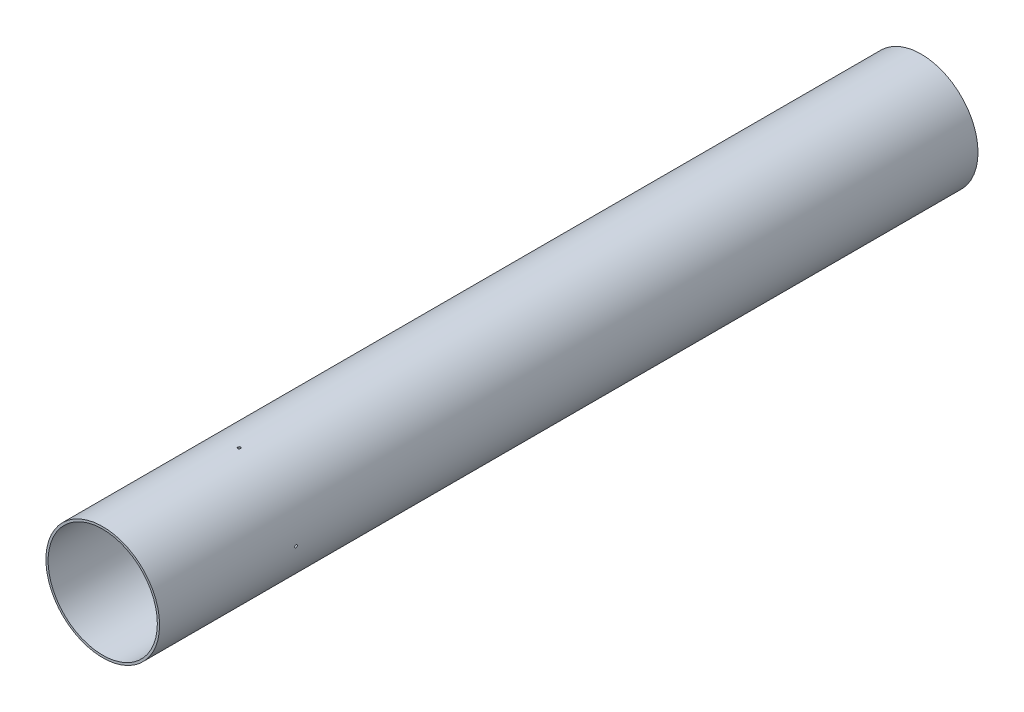
from build123d import *

# Parameters (mm, degrees)
SKETCH1_R           = 31.75
SKETCH1_R_2         = 30.5054
BOSS_EXTRUDE1_DEPTH = 457.2
SKETCH3_R           = 0.75
CUT_EXTRUDE1_DEPTH  = 460.399570091
CIRPATTERN1_COUNT   = 4


with BuildPart() as part:
    # Sketch1 → Boss-Extrude1 (new body)
    with BuildSketch(Plane.XY):
        Circle(SKETCH1_R)
        Circle(SKETCH1_R_2, mode=Mode.SUBTRACT)
    extrude(amount=BOSS_EXTRUDE1_DEPTH)

    # Sketch3 → Cut-Extrude1 (cut, symmetric)
    with BuildSketch(Plane(origin=(0, 0, 0), x_dir=(1, 0, 0), z_dir=(0, 1, 0))):
        with Locations(Location((0, -381, 0), (0, 0, 270))):
            Circle(SKETCH3_R)
    cut_extrude1 = extrude(amount=CUT_EXTRUDE1_DEPTH, both=True, mode=Mode.SUBTRACT)

    # CirPattern1: Cut-Extrude1 ×4 about axis
    cirpattern1_axis = Axis((0, 0, 457.2), (0, 0, -1))
    for i in range(1, CIRPATTERN1_COUNT):
        add(cut_extrude1.rotate(cirpattern1_axis, i * 360 / CIRPATTERN1_COUNT), mode=Mode.SUBTRACT)


solid = part.part
